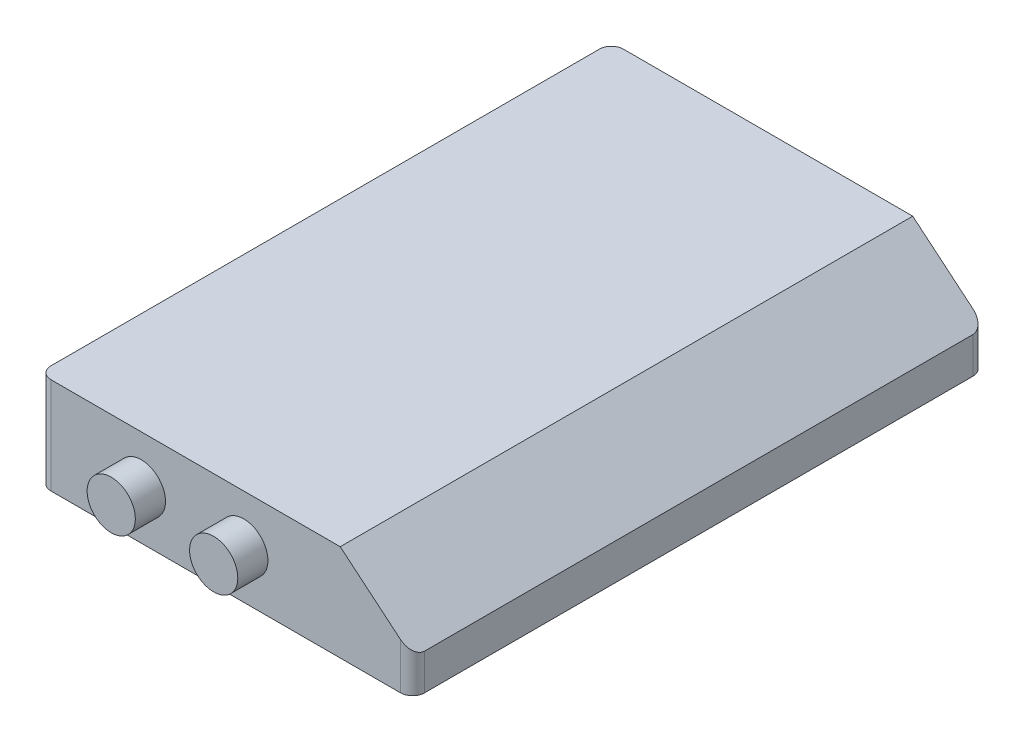
from build123d import *

# Parameters (mm, degrees)
SKETCH_1_W      = 50
SKETCH_1_H      = 16
EXTRUDE_1_DEPTH = 95
FILLET_1_R      = 2
SKETCH_2_R      = 4
EXTRUDE_2_DEPTH = 5


with BuildPart() as part:
    # 草图1 → 凸台-拉伸1 (new body)
    with BuildSketch(Plane.XY):
        with Locations((25, 8)):
            Rectangle(SKETCH_1_W, SKETCH_1_H)
        Polygon((62, 0), (62, 6), (50, 16), (50, 0), align=None)
    extrude(amount=-EXTRUDE_1_DEPTH)

    # 圆角1
    fillet_1_edges = [part.edges().sort_by_distance(p)[0] for p in [
        (62, 3, -95),
        (0, 8, -95),
        (0, 8, 0),
        (62, 3, 0),
    ]]
    fillet(fillet_1_edges, radius=FILLET_1_R)

    # 草图2 → 凸台-拉伸2 (add)
    with BuildSketch(Plane.XY):
        with Locations((17, 8)):
            Circle(SKETCH_2_R)
        with Locations((34, 8)):
            Circle(SKETCH_2_R)
    extrude(amount=EXTRUDE_2_DEPTH)


solid = part.part
